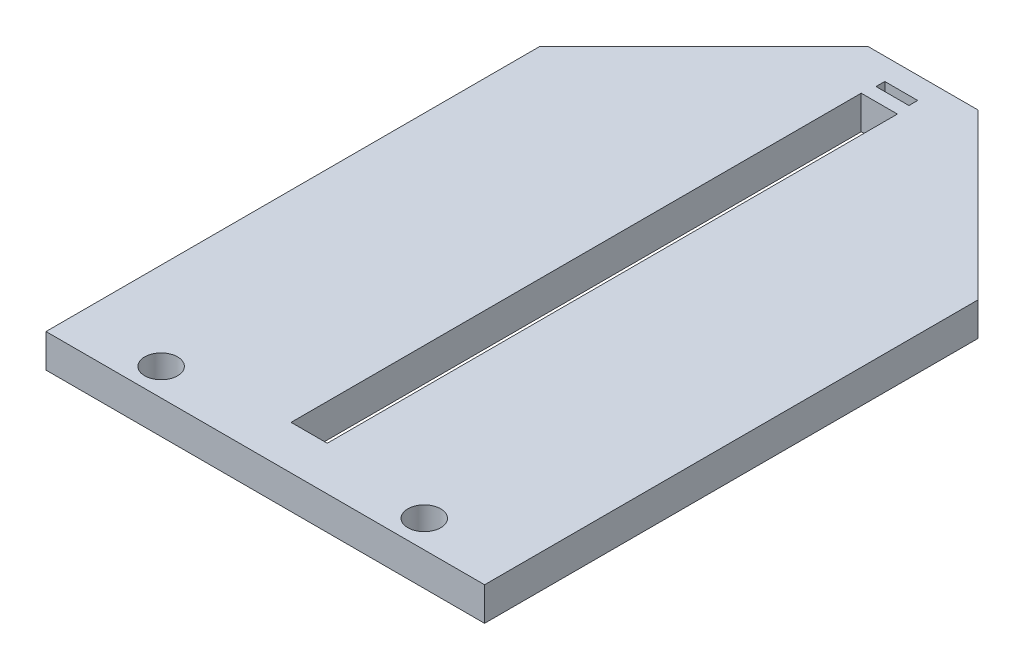
from build123d import *

# Parameters (mm, degrees)
SKETCH1_W           = 40
SKETCH1_H           = 60
BOSS_EXTRUDE1_DEPTH = 3.05
SKETCH4_W           = 3.3
SKETCH4_H           = 52
SKETCH4_W_2         = 3
SKETCH4_H_2         = 0.8
CUT_EXTRUDE1_DEPTH  = 10
CUT_EXTRUDE3_DEPTH  = 10
SKETCH7_R           = 1.5
CUT_EXTRUDE4_DEPTH  = 10


with BuildPart() as part:
    # Sketch1 → Boss-Extrude1 (new body)
    with BuildSketch(Plane(origin=(0, 0, 0), x_dir=(1, 0, 0), z_dir=(0, 1, 0))):
        with Locations((20, 30)):
            Rectangle(SKETCH1_W, SKETCH1_H)
    extrude(amount=BOSS_EXTRUDE1_DEPTH)

    # Sketch4 → Cut-Extrude1 (cut)
    with BuildSketch(Plane(origin=(0, 3.05, 0), x_dir=(1, 0, 0), z_dir=(0, 1, 0))):
        with Locations((20, 30)):
            Rectangle(SKETCH4_W, SKETCH4_H)
        with Locations((20, 57.6)):
            Rectangle(SKETCH4_W_2, SKETCH4_H_2)
    extrude(amount=-CUT_EXTRUDE1_DEPTH, mode=Mode.SUBTRACT)

    # Sketch6 → Cut-Extrude3 (cut)
    with BuildSketch(Plane(origin=(0, 3.05, 0), x_dir=(1, 0, 0), z_dir=(0, 1, 0))):
        Polygon((0, 60), (0, 45), (15, 60), align=None)
        Polygon((40, 60), (40, 45), (25, 60), align=None)
    extrude(amount=-CUT_EXTRUDE3_DEPTH, mode=Mode.SUBTRACT)

    # Sketch7 → Cut-Extrude4 (cut)
    with BuildSketch(Plane(origin=(0, 3.05, 0), x_dir=(1, 0, 0), z_dir=(0, 1, 0))):
        with Locations(Location((8, 2.5, 0), (0, 0, 270))):
            Circle(SKETCH7_R)
        with Locations(Location((32, 2.5, 0), (0, 0, 270))):
            Circle(SKETCH7_R)
    extrude(amount=-CUT_EXTRUDE4_DEPTH, mode=Mode.SUBTRACT)


solid = part.part
